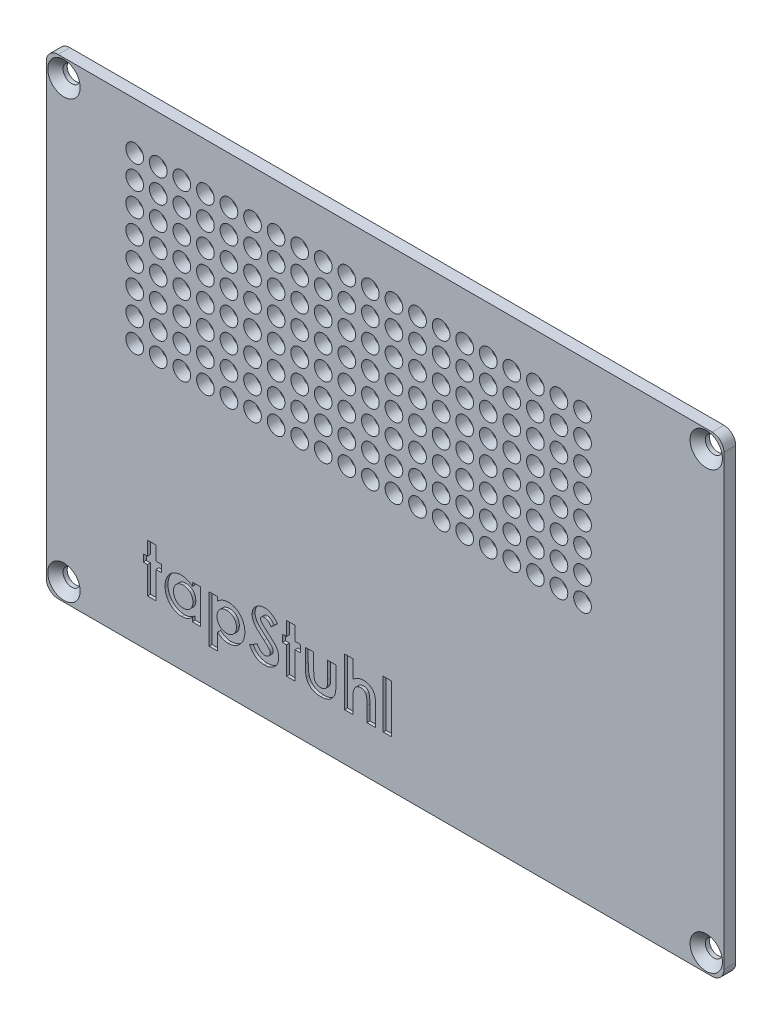
from build123d import *

# Parameters (mm, degrees)
BOSS_EXTRUDE1_DEPTH                          = 2
BOSS_EXTRUDE2_DEPTH                          = 1
SKETCH5_R                                    = 1.5
CUT_EXTRUDE1_DEPTH                           = 141.121375957
CSK_FOR_M2_5_COUNTERSUNK_FLAT_HEAD_S_2_COUNT = 2
CSK_FOR_M2_5_COUNTERSUNK_FLAT_HEAD_S_2_PITCH = 74
CSK_FOR_M2_5_COUNTERSUNK_FLAT_HEAD_S_3_COUNT = 2
CSK_FOR_M2_5_COUNTERSUNK_FLAT_HEAD_S_3_PITCH = 131.74596768
CSK_FOR_M2_5_COUNTERSUNK_FLAT_HEAD_S_4_COUNT = 2
CSK_FOR_M2_5_COUNTERSUNK_FLAT_HEAD_S_4_PITCH = 109
SKETCH12_W                                   = 1.435897436
SKETCH12_H                                   = 8.205128205
CUT_EXTRUDE2_DEPTH                           = 0.5


with BuildPart() as part:
    # Sketch1 → Boss-Extrude1 (new body)
    with BuildSketch(Plane.XY):
        with BuildLine():
            Line((113, 80), (2, 80))
            ThreePointArc((2, 80), (0.585786438, 79.414213562), (0, 78))
            Line((0, 78), (0, 2))
            ThreePointArc((0, 2), (0.585786438, 0.585786438), (2, 0))
            Line((2, 0), (113, 0))
            ThreePointArc((113, 0), (114.414213562, 0.585786438), (115, 2))
            Line((115, 2), (115, 78))
            ThreePointArc((115, 78), (114.414213562, 79.414213562), (113, 80))
        make_face()
    extrude(amount=BOSS_EXTRUDE1_DEPTH)

    # Sketch4 → Boss-Extrude2 (add)
    with BuildSketch(Plane(origin=(0, 0, 0), x_dir=(-1, 0, 0), z_dir=(0, 0, -1))):
        with BuildLine():
            Line((-7.523059585, 77.3), (-107.417157288, 77.3))
            Line((-107.417157288, 77.3), (-112.3, 72.417157288))
            Line((-112.3, 72.417157288), (-112.3, 7.582842712))
            Line((-112.3, 7.582842712), (-107.417157288, 2.7))
            Line((-107.417157288, 2.7), (-7.582842712, 2.7))
            Line((-7.582842712, 2.7), (-2.7, 7.582842712))
            Line((-2.7, 7.582842712), (-2.7, 72.476940415))
            ThreePointArc((-2.7, 72.476940415), (-4.425843797, 75.574156203), (-7.523059585, 77.3))
        make_face()
        with BuildLine():
            Line((-7.70897638, 75.8), (-106.795836944, 75.8))
            Line((-106.795836944, 75.8), (-110.8, 71.795836944))
            Line((-110.8, 71.795836944), (-110.8, 8.204163056))
            Line((-110.8, 8.204163056), (-106.795836944, 4.2))
            Line((-106.795836944, 4.2), (-8.204163056, 4.2))
            Line((-8.204163056, 4.2), (-4.2, 8.204163056))
            Line((-4.2, 8.204163056), (-4.2, 72.29102362))
            ThreePointArc((-4.2, 72.29102362), (-5.486503969, 74.513496031), (-7.70897638, 75.8))
        make_face(mode=Mode.SUBTRACT)
    extrude(amount=BOSS_EXTRUDE2_DEPTH)

    # Sketch5 → Cut-Extrude1 (cut, through all)
    with BuildSketch(Plane.XY.offset(2)):
        with Locations((15, 72)):
            Circle(SKETCH5_R)
        with Locations((19, 72)):
            Circle(SKETCH5_R)
        with Locations((23, 72)):
            Circle(SKETCH5_R)
        with Locations((27, 72)):
            Circle(SKETCH5_R)
        with Locations((31, 72)):
            Circle(SKETCH5_R)
        with Locations((35, 72)):
            Circle(SKETCH5_R)
        with Locations((39, 72)):
            Circle(SKETCH5_R)
        with Locations((43, 72)):
            Circle(SKETCH5_R)
        with Locations((19, 68)):
            Circle(SKETCH5_R)
        with Locations((23, 68)):
            Circle(SKETCH5_R)
        with Locations((27, 68)):
            Circle(SKETCH5_R)
        with Locations((31, 68)):
            Circle(SKETCH5_R)
        with Locations((35, 68)):
            Circle(SKETCH5_R)
        with Locations((39, 68)):
            Circle(SKETCH5_R)
        with Locations((43, 68)):
            Circle(SKETCH5_R)
        with Locations((19, 64)):
            Circle(SKETCH5_R)
        with Locations((23, 64)):
            Circle(SKETCH5_R)
        with Locations((27, 64)):
            Circle(SKETCH5_R)
        with Locations((31, 64)):
            Circle(SKETCH5_R)
        with Locations((35, 64)):
            Circle(SKETCH5_R)
        with Locations((39, 64)):
            Circle(SKETCH5_R)
        with Locations((43, 64)):
            Circle(SKETCH5_R)
        with Locations((19, 60)):
            Circle(SKETCH5_R)
        with Locations((23, 60)):
            Circle(SKETCH5_R)
        with Locations((27, 60)):
            Circle(SKETCH5_R)
        with Locations((31, 60)):
            Circle(SKETCH5_R)
        with Locations((35, 60)):
            Circle(SKETCH5_R)
        with Locations((39, 60)):
            Circle(SKETCH5_R)
        with Locations((43, 60)):
            Circle(SKETCH5_R)
        with Locations((15, 68)):
            Circle(SKETCH5_R)
        with Locations((15, 64)):
            Circle(SKETCH5_R)
        with Locations((15, 60)):
            Circle(SKETCH5_R)
        with Locations((15, 56)):
            Circle(SKETCH5_R)
        with Locations((19, 56)):
            Circle(SKETCH5_R)
        with Locations((23, 56)):
            Circle(SKETCH5_R)
        with Locations((27, 56)):
            Circle(SKETCH5_R)
        with Locations((31, 56)):
            Circle(SKETCH5_R)
        with Locations((35, 56)):
            Circle(SKETCH5_R)
        with Locations((39, 56)):
            Circle(SKETCH5_R)
        with Locations((43, 56)):
            Circle(SKETCH5_R)
        with Locations((15, 52)):
            Circle(SKETCH5_R)
        with Locations((19, 52)):
            Circle(SKETCH5_R)
        with Locations((23, 52)):
            Circle(SKETCH5_R)
        with Locations((27, 52)):
            Circle(SKETCH5_R)
        with Locations((31, 52)):
            Circle(SKETCH5_R)
        with Locations((35, 52)):
            Circle(SKETCH5_R)
        with Locations((39, 52)):
            Circle(SKETCH5_R)
        with Locations((43, 52)):
            Circle(SKETCH5_R)
        with Locations((15, 48)):
            Circle(SKETCH5_R)
        with Locations((19, 48)):
            Circle(SKETCH5_R)
        with Locations((23, 48)):
            Circle(SKETCH5_R)
        with Locations((27, 48)):
            Circle(SKETCH5_R)
        with Locations((31, 48)):
            Circle(SKETCH5_R)
        with Locations((35, 48)):
            Circle(SKETCH5_R)
        with Locations((39, 48)):
            Circle(SKETCH5_R)
        with Locations((43, 48)):
            Circle(SKETCH5_R)
        with Locations((47, 72)):
            Circle(SKETCH5_R)
        with Locations((51, 72)):
            Circle(SKETCH5_R)
        with Locations((47, 68)):
            Circle(SKETCH5_R)
        with Locations((51, 68)):
            Circle(SKETCH5_R)
        with Locations((47, 64)):
            Circle(SKETCH5_R)
        with Locations((51, 64)):
            Circle(SKETCH5_R)
        with Locations((47, 60)):
            Circle(SKETCH5_R)
        with Locations((51, 60)):
            Circle(SKETCH5_R)
        with Locations((47, 56)):
            Circle(SKETCH5_R)
        with Locations((51, 56)):
            Circle(SKETCH5_R)
        with Locations((47, 52)):
            Circle(SKETCH5_R)
        with Locations((51, 52)):
            Circle(SKETCH5_R)
        with Locations((47, 48)):
            Circle(SKETCH5_R)
        with Locations((51, 48)):
            Circle(SKETCH5_R)
        with Locations((55, 72)):
            Circle(SKETCH5_R)
        with Locations((59, 72)):
            Circle(SKETCH5_R)
        with Locations((63, 72)):
            Circle(SKETCH5_R)
        with Locations((67, 72)):
            Circle(SKETCH5_R)
        with Locations((71, 72)):
            Circle(SKETCH5_R)
        with Locations((75, 72)):
            Circle(SKETCH5_R)
        with Locations((79, 72)):
            Circle(SKETCH5_R)
        with Locations((83, 72)):
            Circle(SKETCH5_R)
        with Locations((87, 72)):
            Circle(SKETCH5_R)
        with Locations((91, 72)):
            Circle(SKETCH5_R)
        with Locations((55, 68)):
            Circle(SKETCH5_R)
        with Locations((59, 68)):
            Circle(SKETCH5_R)
        with Locations((63, 68)):
            Circle(SKETCH5_R)
        with Locations((67, 68)):
            Circle(SKETCH5_R)
        with Locations((71, 68)):
            Circle(SKETCH5_R)
        with Locations((75, 68)):
            Circle(SKETCH5_R)
        with Locations((79, 68)):
            Circle(SKETCH5_R)
        with Locations((83, 68)):
            Circle(SKETCH5_R)
        with Locations((87, 68)):
            Circle(SKETCH5_R)
        with Locations((91, 68)):
            Circle(SKETCH5_R)
        with Locations((55, 64)):
            Circle(SKETCH5_R)
        with Locations((59, 64)):
            Circle(SKETCH5_R)
        with Locations((63, 64)):
            Circle(SKETCH5_R)
        with Locations((67, 64)):
            Circle(SKETCH5_R)
        with Locations((71, 64)):
            Circle(SKETCH5_R)
        with Locations((75, 64)):
            Circle(SKETCH5_R)
        with Locations((79, 64)):
            Circle(SKETCH5_R)
        with Locations((83, 64)):
            Circle(SKETCH5_R)
        with Locations((87, 64)):
            Circle(SKETCH5_R)
        with Locations((91, 64)):
            Circle(SKETCH5_R)
        with Locations((55, 60)):
            Circle(SKETCH5_R)
        with Locations((59, 60)):
            Circle(SKETCH5_R)
        with Locations((63, 60)):
            Circle(SKETCH5_R)
        with Locations((67, 60)):
            Circle(SKETCH5_R)
        with Locations((71, 60)):
            Circle(SKETCH5_R)
        with Locations((75, 60)):
            Circle(SKETCH5_R)
        with Locations((79, 60)):
            Circle(SKETCH5_R)
        with Locations((83, 60)):
            Circle(SKETCH5_R)
        with Locations((87, 60)):
            Circle(SKETCH5_R)
        with Locations((91, 60)):
            Circle(SKETCH5_R)
        with Locations((55, 56)):
            Circle(SKETCH5_R)
        with Locations((59, 56)):
            Circle(SKETCH5_R)
        with Locations((63, 56)):
            Circle(SKETCH5_R)
        with Locations((67, 56)):
            Circle(SKETCH5_R)
        with Locations((71, 56)):
            Circle(SKETCH5_R)
        with Locations((75, 56)):
            Circle(SKETCH5_R)
        with Locations((79, 56)):
            Circle(SKETCH5_R)
        with Locations((83, 56)):
            Circle(SKETCH5_R)
        with Locations((87, 56)):
            Circle(SKETCH5_R)
        with Locations((91, 56)):
            Circle(SKETCH5_R)
        with Locations((55, 52)):
            Circle(SKETCH5_R)
        with Locations((59, 52)):
            Circle(SKETCH5_R)
        with Locations((63, 52)):
            Circle(SKETCH5_R)
        with Locations((67, 52)):
            Circle(SKETCH5_R)
        with Locations((71, 52)):
            Circle(SKETCH5_R)
        with Locations((75, 52)):
            Circle(SKETCH5_R)
        with Locations((79, 52)):
            Circle(SKETCH5_R)
        with Locations((83, 52)):
            Circle(SKETCH5_R)
        with Locations((87, 52)):
            Circle(SKETCH5_R)
        with Locations((91, 52)):
            Circle(SKETCH5_R)
        with Locations((55, 48)):
            Circle(SKETCH5_R)
        with Locations((59, 48)):
            Circle(SKETCH5_R)
        with Locations((63, 48)):
            Circle(SKETCH5_R)
        with Locations((67, 48)):
            Circle(SKETCH5_R)
        with Locations((71, 48)):
            Circle(SKETCH5_R)
        with Locations((75, 48)):
            Circle(SKETCH5_R)
        with Locations((79, 48)):
            Circle(SKETCH5_R)
        with Locations((83, 48)):
            Circle(SKETCH5_R)
        with Locations((87, 48)):
            Circle(SKETCH5_R)
        with Locations((91, 48)):
            Circle(SKETCH5_R)
        with Locations((15, 44)):
            Circle(SKETCH5_R)
        with Locations((19, 44)):
            Circle(SKETCH5_R)
        with Locations((23, 44)):
            Circle(SKETCH5_R)
        with Locations((27, 44)):
            Circle(SKETCH5_R)
        with Locations((31, 44)):
            Circle(SKETCH5_R)
        with Locations((35, 44)):
            Circle(SKETCH5_R)
        with Locations((39, 44)):
            Circle(SKETCH5_R)
        with Locations((43, 44)):
            Circle(SKETCH5_R)
        with Locations((47, 44)):
            Circle(SKETCH5_R)
        with Locations((51, 44)):
            Circle(SKETCH5_R)
        with Locations((55, 44)):
            Circle(SKETCH5_R)
        with Locations((59, 44)):
            Circle(SKETCH5_R)
        with Locations((63, 44)):
            Circle(SKETCH5_R)
        with Locations((67, 44)):
            Circle(SKETCH5_R)
        with Locations((71, 44)):
            Circle(SKETCH5_R)
        with Locations((75, 44)):
            Circle(SKETCH5_R)
        with Locations((79, 44)):
            Circle(SKETCH5_R)
        with Locations((83, 44)):
            Circle(SKETCH5_R)
        with Locations((87, 44)):
            Circle(SKETCH5_R)
        with Locations((91, 44)):
            Circle(SKETCH5_R)
    extrude(amount=-CUT_EXTRUDE1_DEPTH, mode=Mode.SUBTRACT)

    # Sketch11 → CSK for M2.5 Countersunk Flat Head Screw1 (revolve, cut)
    with BuildSketch(Plane(origin=(3, 77, 2), x_dir=(0, -1, 0), z_dir=(1, 0, 0))):
        Polygon((0, 0), (0, 2), (1.45, 2), (1.45, 1.3), (2.75, 0), align=None)
    csk_for_m2_5_countersunk_flat_head_screw = revolve(axis=Axis((3, 77, 8.35), (0, 0, -1)), mode=Mode.SUBTRACT)

    # CSK for M2.5 Countersunk Flat Head S 2: CSK for M2.5 Countersunk Flat Head Screw1 ×2
    with Locations(*[(0, -i * CSK_FOR_M2_5_COUNTERSUNK_FLAT_HEAD_S_2_PITCH, 0) for i in range(1, CSK_FOR_M2_5_COUNTERSUNK_FLAT_HEAD_S_2_COUNT)]):
        add(csk_for_m2_5_countersunk_flat_head_screw, mode=Mode.SUBTRACT)

    # CSK for M2.5 Countersunk Flat Head S 3: CSK for M2.5 Countersunk Flat Head Screw1 ×2
    with Locations(*[Vector(0.8273497999161711, -0.5616870201265752, 0) * (i * CSK_FOR_M2_5_COUNTERSUNK_FLAT_HEAD_S_3_PITCH) for i in range(1, CSK_FOR_M2_5_COUNTERSUNK_FLAT_HEAD_S_3_COUNT)]):
        add(csk_for_m2_5_countersunk_flat_head_screw, mode=Mode.SUBTRACT)

    # CSK for M2.5 Countersunk Flat Head S 4: CSK for M2.5 Countersunk Flat Head Screw1 ×2
    with Locations(*[(i * CSK_FOR_M2_5_COUNTERSUNK_FLAT_HEAD_S_4_PITCH, 0, 0) for i in range(1, CSK_FOR_M2_5_COUNTERSUNK_FLAT_HEAD_S_4_COUNT)]):
        add(csk_for_m2_5_countersunk_flat_head_screw, mode=Mode.SUBTRACT)

    # Sketch12 → Cut-Extrude2 (cut)
    # profile 1 of 8: a face of its own
    with BuildSketch(Plane.XY.offset(2)):
        Polygon((17.184704169, 16.205128205), (18.620601605, 16.205128205), (18.620601605, 13.846153846), (19.543678528, 13.846153846), (19.543678528, 12.615384615), (18.620601605, 12.615384615), (18.620601605, 8), (17.184704169, 8), (17.184704169, 12.615384615), (16.466755451, 12.615384615), (16.466755451, 13.846153846), (17.184704169, 13.846153846), align=None)
    # profile 2 of 8: a face of its own
    with BuildSketch(Plane.XY.offset(2)):
        with BuildLine():
            Line((24.774447758, 13.846153846), (26.210345194, 13.846153846))
            Line((26.210345194, 13.846153846), (26.210345194, 8))
            Line((26.210345194, 8), (24.774447758, 8))
            Line((24.774447758, 8), (24.774447758, 8.637820513))
            add(Edge.make_bspline(
                [(24.774447758, 8.637820513), (24.70329957, 8.575735745), (24.565214985, 8.455241472), (24.347638362, 8.298897088), (24.129425955, 8.169933177), (23.909529247, 8.067220456), (23.684568518, 7.991377683), (23.452924141, 7.936465743), (23.211260191, 7.904082829), (23.046980367, 7.899674621), (22.963550323, 7.897435897)],
                knots=[0, 0, 0, 0, 1.129196829, 2.191548051, 3.199897424, 4.157751732, 5.089409408, 6.034969131, 7.002052659, 8, 8, 8, 8], degree=3))
            add(Edge.make_bspline(
                [(22.963550323, 7.897435897), (22.869896389, 7.899542818), (22.684830907, 7.903706212), (22.413267859, 7.947532657), (22.151046737, 8.014618799), (21.898380394, 8.109554075), (21.655728532, 8.23257158), (21.421234129, 8.380461618), (21.198917133, 8.558416011), (20.986926831, 8.758735128), (20.792829783, 8.979087582), (20.62314831, 9.216414911), (20.48011944, 9.467351151), (20.36294354, 9.731064332), (20.270769563, 10.007360905), (20.205062707, 10.297117197), (20.166295586, 10.600436696), (20.161497309, 10.80704606), (20.159063143, 10.911858974)],
                knots=[0, 0, 0, 0, 0.980476535, 1.937477201, 2.874147792, 3.812856188, 4.758993464, 5.720109578, 6.712210464, 7.737600662, 8.772720504, 9.783789959, 10.789002326, 11.793715968, 12.802552247, 13.835794126, 14.902098527, 16, 16, 16, 16], degree=3))
            add(Edge.make_bspline(
                [(20.159063143, 10.911858974), (20.161617809, 11.020392885), (20.166629071, 11.233294244), (20.203286152, 11.545716865), (20.26778047, 11.842657641), (20.355723108, 12.124527878), (20.468846041, 12.391376271), (20.606622215, 12.643640005), (20.770925946, 12.880659702), (20.960256869, 13.09840112), (21.164687763, 13.297971647), (21.38339268, 13.471713617), (21.612951553, 13.619315505), (21.853608329, 13.739815925), (22.10532864, 13.832932551), (22.367118698, 13.901008408), (22.640140666, 13.941856314), (22.826125444, 13.946411742), (22.920281092, 13.948717949)],
                knots=[0, 0, 0, 0, 1.136281865, 2.228943489, 3.287578264, 4.313574083, 5.316051562, 6.317280042, 7.318008486, 8.329309503, 9.333984563, 10.305318864, 11.248632312, 12.186624717, 13.117503092, 14.05354244, 15.014596925, 16, 16, 16, 16], degree=3))
            add(Edge.make_bspline(
                [(22.920281092, 13.948717949), (23.00749973, 13.946905963), (23.180073976, 13.943320697), (23.433733254, 13.904391569), (23.679746168, 13.845514026), (23.916770706, 13.761624127), (24.146751021, 13.655696062), (24.365731308, 13.5229603), (24.578501958, 13.368995668), (24.708325508, 13.248746028), (24.774447758, 13.1875)],
                knots=[0, 0, 0, 0, 1.017011718, 2.012299608, 2.98747302, 3.965332399, 4.941441765, 5.936729654, 6.94912688, 8, 8, 8, 8], degree=3))
            Line((24.774447758, 13.1875), (24.774447758, 13.846153846))
        make_face()
        with BuildLine():
            add(Edge.make_bspline(
                [(23.221563143, 12.615384615), (23.164346863, 12.613629022), (23.05220669, 12.610188175), (22.887289219, 12.589491236), (22.72967759, 12.553022309), (22.580495877, 12.4991473), (22.437520723, 12.433519689), (22.30292323, 12.351322187), (22.175592523, 12.254166486), (22.056277448, 12.144404724), (21.947504176, 12.02375648), (21.853735268, 11.892103105), (21.774046845, 11.752991911), (21.70665115, 11.606004637), (21.658411123, 11.449401969), (21.620205042, 11.285222597), (21.600378559, 11.112125258), (21.596784643, 10.994164779), (21.594960579, 10.934294872)],
                knots=[0, 0, 0, 0, 1.04836806, 2.054732945, 3.03993516, 4.00574415, 4.955904794, 5.917688631, 6.888591924, 7.88601754, 8.884115178, 9.859153345, 10.841239365, 11.818093293, 12.814750328, 13.83810466, 14.90274714, 16, 16, 16, 16], degree=3))
            add(Edge.make_bspline(
                [(21.594960579, 10.934294872), (21.59675678, 10.87388191), (21.600296172, 10.754838869), (21.620525617, 10.580281392), (21.657356886, 10.413703745), (21.711092318, 10.256452594), (21.776715745, 10.106406102), (21.856594214, 9.964256747), (21.954710923, 9.832517907), (22.063579546, 9.7080722), (22.185342351, 9.596947012), (22.313393547, 9.498278049), (22.44948221, 9.41572179), (22.592131877, 9.3489993), (22.74086238, 9.294626079), (22.89753835, 9.258615491), (23.060624949, 9.235594604), (23.171805389, 9.232388795), (23.227973399, 9.230769231)],
                knots=[0, 0, 0, 0, 1.099136573, 2.165835871, 3.191374663, 4.196217796, 5.183857741, 6.167377911, 7.154730987, 8.166690795, 9.170734848, 10.148332609, 11.103258353, 12.059567475, 13.009337315, 13.978056681, 14.978520572, 16, 16, 16, 16], degree=3))
            add(Edge.make_bspline(
                [(23.227973399, 9.230769231), (23.2862554, 9.232534666), (23.400519803, 9.235995879), (23.568127819, 9.256503935), (23.727856738, 9.293106579), (23.879042001, 9.347290035), (24.023992819, 9.41244657), (24.161401142, 9.49303787), (24.289775882, 9.589970625), (24.409767199, 9.700724636), (24.519716109, 9.822358046), (24.614781767, 9.955737845), (24.697587433, 10.096598182), (24.76271028, 10.248269509), (24.814426953, 10.408098286), (24.851532473, 10.577076443), (24.871715724, 10.755386159), (24.875224161, 10.877089489), (24.877011861, 10.939102564)],
                knots=[0, 0, 0, 0, 1.050008698, 2.058587853, 3.036635738, 3.995319155, 4.947022481, 5.895997462, 6.858296291, 7.838991643, 8.833936038, 9.806048392, 10.784806122, 11.771666913, 12.772873988, 13.80724452, 14.882696879, 16, 16, 16, 16], degree=3))
            add(Edge.make_bspline(
                [(24.877011861, 10.939102564), (24.875246375, 11.000049044), (24.871797869, 11.119095223), (24.851445428, 11.293681916), (24.81407648, 11.459342114), (24.763424221, 11.616380321), (24.697142819, 11.764437469), (24.6142745, 11.90187196), (24.520251658, 12.033445383), (24.409085454, 12.151792801), (24.289744158, 12.261744868), (24.159481459, 12.355746306), (24.02240134, 12.436759354), (23.877661577, 12.50327419), (23.723921947, 12.552032087), (23.563920063, 12.589783543), (23.395159562, 12.610175753), (23.280372915, 12.613619994), (23.221563143, 12.615384615)],
                knots=[0, 0, 0, 0, 1.106611376, 2.161533483, 3.185006901, 4.184773755, 5.152708835, 6.122342771, 7.094156588, 8.082475533, 9.064254463, 10.03606828, 10.992420271, 11.951521816, 12.920622147, 13.915721683, 14.932141191, 16, 16, 16, 16], degree=3))
        make_face(mode=Mode.SUBTRACT)
    # profile 3 of 8: a face of its own
    with BuildSketch(Plane.XY.offset(2)):
        with BuildLine():
            Line((29.082140066, 13.846153846), (29.082140066, 13.1875))
            add(Edge.make_bspline(
                [(29.082140066, 13.1875), (29.148802475, 13.248748216), (29.279720567, 13.369033391), (29.4940689, 13.523034321), (29.714344168, 13.655297223), (29.944593697, 13.761678991), (30.181657618, 13.845499403), (30.427660162, 13.904395444), (30.680792708, 13.943238964), (30.852829175, 13.946882239), (30.939511861, 13.948717949)],
                knots=[0, 0, 0, 0, 1.054376801, 2.070687235, 3.070225973, 4.045259405, 5.022040922, 5.996139433, 6.99033025, 8, 8, 8, 8], degree=3))
            add(Edge.make_bspline(
                [(30.939511861, 13.948717949), (31.033676449, 13.946462469), (31.219150133, 13.942019907), (31.492039368, 13.900542206), (31.753554426, 13.833496356), (32.004692532, 13.739882076), (32.244115651, 13.618339568), (32.474513871, 13.472815364), (32.691913706, 13.297304335), (32.896420839, 13.098508668), (33.085595031, 12.880613848), (33.25014174, 12.643715934), (33.387202763, 12.390932957), (33.503368714, 12.125253338), (33.588151291, 11.842270872), (33.653494627, 11.545781576), (33.689907601, 11.233277089), (33.694952744, 11.020387092), (33.697524682, 10.911858974)],
                knots=[0, 0, 0, 0, 0.985987466, 1.942075377, 2.884088208, 3.810275091, 4.743821533, 5.692411115, 6.659945104, 7.665215984, 8.677116751, 9.678438675, 10.680260931, 11.685531812, 12.710472044, 13.769734641, 14.863044265, 16, 16, 16, 16], degree=3))
            add(Edge.make_bspline(
                [(33.697524682, 10.911858974), (33.695090514, 10.807046063), (33.690292232, 10.600436705), (33.651525143, 10.297117165), (33.585818172, 10.00736102), (33.493644609, 9.731063915), (33.376467177, 9.467352703), (33.233444034, 9.216409097), (33.063740894, 8.979109637), (32.869726412, 8.758650986), (32.657737397, 8.559009289), (32.436860038, 8.379890995), (32.202695185, 8.233117598), (31.961096435, 8.109156221), (31.708257693, 8.014365354), (31.445905959, 7.947953698), (31.174456732, 7.903553386), (30.989904321, 7.89949537), (30.89624263, 7.897435897)],
                knots=[0, 0, 0, 0, 1.098553145, 2.165490463, 3.199345634, 4.208780719, 5.21409072, 6.219899742, 7.23156933, 8.267303578, 9.293302409, 10.281606823, 11.243293419, 12.184993323, 13.124258899, 14.066907486, 15.018941492, 16, 16, 16, 16], degree=3))
            add(Edge.make_bspline(
                [(30.89624263, 7.897435897), (30.812779224, 7.89946005), (30.648361336, 7.90344751), (30.40658866, 7.939000775), (30.173033508, 7.992105267), (29.947386936, 8.072033448), (29.727112272, 8.178097473), (29.508457965, 8.310181038), (29.290918405, 8.471543596), (29.153225974, 8.596002514), (29.082140066, 8.66025641)],
                knots=[0, 0, 0, 0, 0.990856396, 1.951927477, 2.896945079, 3.83213376, 4.788585491, 5.796263726, 6.862286081, 8, 8, 8, 8], degree=3))
            Line((29.082140066, 8.66025641), (29.082140066, 5.846153846))
            Line((29.082140066, 5.846153846), (27.64624263, 5.846153846))
            Line((27.64624263, 5.846153846), (27.64624263, 13.846153846))
            Line((27.64624263, 13.846153846), (29.082140066, 13.846153846))
        make_face()
        with BuildLine():
            add(Edge.make_bspline(
                [(30.628614425, 12.615384615), (30.570341423, 12.613592681), (30.456094662, 12.610079514), (30.288359608, 12.589945572), (30.12942769, 12.552063415), (29.976882479, 12.502964259), (29.832655636, 12.43668811), (29.69556722, 12.356347794), (29.566791408, 12.2605481), (29.445659856, 12.153082578), (29.336813526, 12.032183663), (29.240113004, 11.902996902), (29.15988704, 11.76384004), (29.093009955, 11.616477569), (29.042554116, 11.459315043), (29.005130502, 11.293689445), (28.984793139, 11.119093208), (28.981342527, 11.000048361), (28.979575964, 10.939102564)],
                knots=[0, 0, 0, 0, 1.060469436, 2.079096586, 3.066888298, 4.028858836, 4.99004353, 5.948472697, 6.914558426, 7.905691313, 8.889602648, 9.869280844, 10.836099585, 11.806137001, 12.808075328, 13.83377171, 14.890985086, 16, 16, 16, 16], degree=3))
            add(Edge.make_bspline(
                [(28.979575964, 10.939102564), (28.981364756, 10.877090166), (28.984875338, 10.755388164), (29.005043162, 10.577068895), (29.042204101, 10.408125052), (29.093722635, 10.248173594), (29.159461716, 10.097193771), (29.239592628, 9.954625876), (29.337357573, 9.823595639), (29.445008185, 9.699509141), (29.566888723, 9.590605707), (29.695084397, 9.492934308), (29.83262233, 9.412474235), (29.977538439, 9.347282558), (30.128733114, 9.293108631), (30.288459442, 9.256503365), (30.456068171, 9.23599603), (30.570332475, 9.232534717), (30.628614425, 9.230769231)],
                knots=[0, 0, 0, 0, 1.117193555, 2.192540452, 3.22680955, 4.227918444, 5.21468246, 6.188555072, 7.166222992, 8.154674427, 9.142376254, 10.104580718, 11.053462639, 12.005072638, 12.963662044, 13.941614018, 14.950094269, 16, 16, 16, 16], degree=3))
            add(Edge.make_bspline(
                [(30.628614425, 9.230769231), (30.684776387, 9.232409314), (30.795944855, 9.235655737), (30.958603158, 9.258308139), (31.11495831, 9.295324416), (31.263785846, 9.348086002), (31.405991736, 9.416781532), (31.542870581, 9.497166672), (31.66969681, 9.597601904), (31.791446027, 9.707988798), (31.900379049, 9.832473466), (31.998105062, 9.964722031), (32.080197817, 10.105914837), (32.14537753, 10.2565201), (32.199263456, 10.413685139), (32.236053078, 10.580286616), (32.256294054, 10.754837495), (32.259831854, 10.873881447), (32.261627246, 10.934294872)],
                knots=[0, 0, 0, 0, 1.021711385, 2.02240246, 2.981887075, 3.941027022, 4.888772411, 5.852236371, 6.822344989, 7.82661704, 8.838806642, 9.826383926, 10.814965113, 11.80282933, 12.807900643, 13.833672313, 14.900613836, 16, 16, 16, 16], degree=3))
            add(Edge.make_bspline(
                [(32.261627246, 10.934294872), (32.259803182, 10.994164779), (32.256209266, 11.112125258), (32.236382782, 11.285222596), (32.198176704, 11.449401974), (32.149936666, 11.60600462), (32.08254101, 11.752991973), (32.002852442, 11.892102872), (31.909084077, 12.023757352), (31.800308734, 12.144401385), (31.681001355, 12.254178789), (31.553642759, 12.351277807), (31.418733097, 12.433936738), (31.274435192, 12.499122667), (31.124154249, 12.552756638), (30.965593662, 12.589700427), (30.799559536, 12.610147186), (30.686361443, 12.613615358), (30.628614425, 12.615384615)],
                knots=[0, 0, 0, 0, 1.094680664, 2.156827393, 3.177782763, 4.17210342, 5.146667393, 6.126451192, 7.099203661, 8.094961544, 9.09004898, 10.058676268, 11.018205477, 11.974998356, 12.947750825, 13.930643515, 14.944335875, 16, 16, 16, 16], degree=3))
        make_face(mode=Mode.SUBTRACT)
    # profile 4 of 8: a face of its own
    with BuildSketch(Plane.XY.offset(2)):
        with BuildLine():
            Line((39.23598622, 14.931089744), (38.162268271, 13.948717949))
            add(Edge.make_bspline(
                [(38.162268271, 13.948717949), (38.116274798, 14.013596524), (38.027973744, 14.13815434), (37.884846946, 14.304940193), (37.742366438, 14.447220936), (37.599212226, 14.564402189), (37.454115445, 14.655771987), (37.307327963, 14.720462813), (37.159681957, 14.761587385), (37.060486632, 14.766708384), (37.011627246, 14.769230769)],
                knots=[0, 0, 0, 0, 1.299362458, 2.494594718, 3.587462134, 4.587049575, 5.512617175, 6.380583204, 7.202344345, 8, 8, 8, 8], degree=3))
            add(Edge.make_bspline(
                [(37.011627246, 14.769230769), (36.966052611, 14.76763247), (36.878059966, 14.764546574), (36.752619922, 14.733873), (36.641252465, 14.680934914), (36.544066283, 14.611713914), (36.467080489, 14.528318657), (36.405613303, 14.440858475), (36.371002111, 14.344322214), (36.366446598, 14.278017215), (36.364191348, 14.245192308)],
                knots=[0, 0, 0, 0, 1.185010067, 2.2879431, 3.333075148, 4.379039566, 5.372662701, 6.27520591, 7.14612461, 8, 8, 8, 8], degree=3))
            add(Edge.make_bspline(
                [(36.364191348, 14.245192308), (36.365604599, 14.21189405), (36.368450689, 14.144835988), (36.395940046, 14.046554046), (36.437374357, 13.950521147), (36.476966533, 13.892061352), (36.497204169, 13.862179487)],
                knots=[0, 0, 0, 0, 0.967525499, 1.948461899, 2.951351359, 4, 4, 4, 4], degree=3))
            add(Edge.make_bspline(
                [(36.497204169, 13.862179487), (36.515602369, 13.838952626), (36.557952596, 13.78548746), (36.638705806, 13.70080697), (36.740114877, 13.597065958), (36.866082245, 13.477831774), (37.011378658, 13.338816288), (37.182738792, 13.185484254), (37.375230155, 13.013087156), (37.512048557, 12.89303606), (37.58374263, 12.830128205)],
                knots=[0, 0, 0, 0, 0.473873513, 1.090794244, 1.870441696, 2.795289791, 3.865433203, 5.087734844, 6.473946851, 8, 8, 8, 8], degree=3))
            add(Edge.make_bspline(
                [(37.58374263, 12.830128205), (37.651037831, 12.771887603), (37.778750142, 12.66135904), (37.960459398, 12.504481491), (38.120151572, 12.363342586), (38.260153012, 12.240060517), (38.378341434, 12.133341773), (38.475213703, 12.04267624), (38.551952948, 11.969829009), (38.595574716, 11.925829237), (38.614191348, 11.907051282)],
                knots=[0, 0, 0, 0, 1.543621617, 2.929473131, 4.163658386, 5.240097082, 6.164993805, 6.925417477, 7.541396219, 8, 8, 8, 8], degree=3))
            add(Edge.make_bspline(
                [(38.614191348, 11.907051282), (38.68481897, 11.830617069), (38.820590062, 11.68368367), (38.997044619, 11.45598311), (39.142272428, 11.233700934), (39.254623414, 11.012654544), (39.339475398, 10.789654678), (39.399297171, 10.559232278), (39.435124828, 10.318979574), (39.439102535, 10.155036433), (39.441114425, 10.072115385)],
                knots=[0, 0, 0, 0, 1.206664779, 2.319633467, 3.337109185, 4.282041471, 5.190008762, 6.099243693, 7.03861361, 8, 8, 8, 8], degree=3))
            add(Edge.make_bspline(
                [(39.441114425, 10.072115385), (39.439682413, 9.991318993), (39.436872753, 9.832793465), (39.402459798, 9.600814968), (39.353388944, 9.378801479), (39.277516796, 9.169168817), (39.185044272, 8.968475928), (39.069116606, 8.779848967), (38.932975459, 8.601378953), (38.776936801, 8.436256255), (38.604339517, 8.286418853), (38.419212526, 8.153030058), (38.219745564, 8.042900617), (38.007642844, 7.952216877), (37.783017902, 7.882371049), (37.546138332, 7.830748472), (37.296641811, 7.799765415), (37.126032495, 7.796526504), (37.038870835, 7.794871795)],
                knots=[0, 0, 0, 0, 1.043214005, 2.046824704, 3.02475056, 3.976699089, 4.921714032, 5.875962561, 6.831408892, 7.817874052, 8.806269674, 9.781291748, 10.760897367, 11.74438705, 12.757449933, 13.795994037, 14.874007457, 16, 16, 16, 16], degree=3))
            add(Edge.make_bspline(
                [(37.038870835, 7.794871795), (36.970449675, 7.796085632), (36.834936537, 7.798489725), (36.63521066, 7.818117146), (36.442352747, 7.849793716), (36.256580037, 7.895195702), (36.077055589, 7.952726176), (35.903772033, 8.022997447), (35.737925601, 8.107098693), (35.578261421, 8.203300457), (35.425555657, 8.315003377), (35.277877406, 8.439923723), (35.136693547, 8.579982827), (35.001326005, 8.734849454), (34.872640897, 8.904962148), (34.746425898, 9.087951777), (34.628290383, 9.287214378), (34.555312821, 9.426998705), (34.518037502, 9.498397436)],
                knots=[0, 0, 0, 0, 1.016823716, 2.013894106, 2.979844003, 3.91962641, 4.853723003, 5.779685073, 6.695824784, 7.614987388, 8.547259901, 9.504950863, 10.487499108, 11.500346958, 12.559593716, 13.656357062, 14.802919212, 16, 16, 16, 16], degree=3))
            Line((34.518037502, 9.498397436), (35.780858015, 10.256410256))
            add(Edge.make_bspline(
                [(35.780858015, 10.256410256), (35.827483868, 10.175363368), (35.916869613, 10.019989555), (36.068342114, 9.811225146), (36.223517958, 9.632452987), (36.385984673, 9.486832886), (36.553766722, 9.372417716), (36.727674534, 9.290648698), (36.907830291, 9.240033769), (37.030544209, 9.233852517), (37.091755451, 9.230769231)],
                knots=[0, 0, 0, 0, 1.283663364, 2.460892379, 3.537111102, 4.529833553, 5.449777664, 6.316464042, 7.160231139, 8, 8, 8, 8], degree=3))
            add(Edge.make_bspline(
                [(37.091755451, 9.230769231), (37.154016047, 9.233287209), (37.274810672, 9.238172454), (37.447229541, 9.283295991), (37.605309689, 9.354143253), (37.741953002, 9.455232527), (37.857653944, 9.571904913), (37.94304788, 9.701708277), (37.996692926, 9.842152384), (38.002364508, 9.939714099), (38.005216989, 9.988782051)],
                knots=[0, 0, 0, 0, 1.13588714, 2.203786484, 3.234766741, 4.283437687, 5.291419208, 6.222934724, 7.106237994, 8, 8, 8, 8], degree=3))
            add(Edge.make_bspline(
                [(38.005216989, 9.988782051), (38.00258284, 10.034431796), (37.997231818, 10.127164882), (37.957817839, 10.265044069), (37.896201768, 10.402860552), (37.823305611, 10.51590136), (37.749124643, 10.610547364), (37.678190906, 10.692553845), (37.591812379, 10.78315665), (37.49020808, 10.88246975), (37.374720466, 10.991367424), (37.245252254, 11.109839008), (37.100320896, 11.236840909), (36.997883126, 11.323353349), (36.944319553, 11.368589744)],
                knots=[0, 0, 0, 0, 0.916159276, 1.861089862, 2.860218735, 3.940849679, 4.552606315, 5.27541173, 6.11797699, 7.06649574, 8.129236253, 9.306560635, 10.591630461, 12, 12, 12, 12], degree=3))
            add(Edge.make_bspline(
                [(36.944319553, 11.368589744), (36.84249307, 11.454744713), (36.647057228, 11.620102176), (36.370881588, 11.864329943), (36.122022608, 12.09258317), (35.902629702, 12.307683565), (35.709907464, 12.505658723), (35.545161092, 12.688116674), (35.410200402, 12.856464831), (35.268183376, 13.055861957), (35.133238808, 13.298841056), (35.016608406, 13.59117308), (34.940943525, 13.883468011), (34.932466327, 14.079698729), (34.928293912, 14.176282051)],
                knots=[0, 0, 0, 0, 1.345494975, 2.582412109, 3.71882943, 4.751509156, 5.681369928, 6.505683931, 7.230279997, 7.856715994, 8.973648664, 10.023341002, 11.027102913, 12, 12, 12, 12], degree=3))
            add(Edge.make_bspline(
                [(34.928293912, 14.176282051), (34.930029214, 14.24477376), (34.933447945, 14.379709782), (34.96394355, 14.578113543), (35.009520394, 14.769556501), (35.075711056, 14.953340186), (35.161618543, 15.129234402), (35.26594985, 15.298100223), (35.390325043, 15.458383449), (35.530487489, 15.609977821), (35.684910619, 15.748517826), (35.849931357, 15.870793262), (36.024615673, 15.974068874), (36.207894935, 16.059743493), (36.400904848, 16.125321971), (36.602223519, 16.171807265), (36.812139701, 16.199455235), (36.954920157, 16.203213656), (37.027652887, 16.205128205)],
                knots=[0, 0, 0, 0, 1.010766082, 1.991317756, 2.957454644, 3.913069143, 4.869106762, 5.843196583, 6.838735724, 7.860187025, 8.887984031, 9.89767229, 10.887916223, 11.879572884, 12.879850636, 13.892031539, 14.926195476, 16, 16, 16, 16], degree=3))
            add(Edge.make_bspline(
                [(37.027652887, 16.205128205), (37.121910904, 16.201680046), (37.309682899, 16.194810946), (37.587309209, 16.141096832), (37.858482982, 16.056625729), (38.07699989, 15.954720636), (38.250869715, 15.856005125), (38.384124694, 15.765120318), (38.519718808, 15.661006885), (38.658745539, 15.54333674), (38.798621555, 15.409892822), (38.9433242, 15.263851868), (39.090881725, 15.103951742), (39.18677072, 14.989719834), (39.23598622, 14.931089744)],
                knots=[0, 0, 0, 0, 1.282922637, 2.555718331, 3.837320111, 5.142675274, 5.830281639, 6.55870424, 7.337177975, 8.157850921, 9.037902056, 9.96903443, 10.957596896, 12, 12, 12, 12], degree=3))
        make_face()
    # profile 5 of 8: a face of its own
    with BuildSketch(Plane.XY.offset(2)):
        Polygon((40.774447758, 16.205128205), (42.210345194, 16.205128205), (42.210345194, 13.846153846), (43.133422117, 13.846153846), (43.133422117, 12.615384615), (42.210345194, 12.615384615), (42.210345194, 8), (40.774447758, 8), (40.774447758, 12.615384615), (40.056499041, 12.615384615), (40.056499041, 13.846153846), (40.774447758, 13.846153846), align=None)
    # profile 6 of 8: a face of its own
    with BuildSketch(Plane.XY.offset(2)):
        with BuildLine():
            Line((43.953934938, 13.846153846), (45.389832374, 13.846153846))
            Line((45.389832374, 13.846153846), (45.389832374, 11.040064103))
            add(Edge.make_bspline(
                [(45.389832374, 11.040064103), (45.389959882, 10.974352254), (45.390204602, 10.84823517), (45.397014356, 10.667106346), (45.406569788, 10.50147233), (45.41849432, 10.35113781), (45.436292448, 10.216464391), (45.456839637, 10.097709167), (45.48013352, 9.994016493), (45.518012316, 9.878437184), (45.577274376, 9.751957858), (45.666770577, 9.617685202), (45.775176579, 9.501578615), (45.901027746, 9.402607711), (46.045609325, 9.324616466), (46.206929363, 9.271762989), (46.382958123, 9.236239957), (46.505561892, 9.232640867), (46.569319553, 9.230769231)],
                knots=[0, 0, 0, 0, 1.267339619, 2.432334223, 3.495366327, 4.467371443, 5.340232306, 6.114347373, 6.791623365, 7.387877112, 8.457231658, 9.474542289, 10.487879852, 11.508108106, 12.54995813, 13.638205937, 14.771795776, 16, 16, 16, 16], degree=3))
            add(Edge.make_bspline(
                [(46.569319553, 9.230769231), (46.633020636, 9.232905438), (46.755941477, 9.237027573), (46.933141426, 9.269173074), (47.094841435, 9.324255461), (47.242702268, 9.398968218), (47.372363499, 9.498958517), (47.485254231, 9.618104053), (47.580305578, 9.758326788), (47.625982134, 9.862928931), (47.649447758, 9.916666667)],
                knots=[0, 0, 0, 0, 1.116871431, 2.155171802, 3.144773418, 4.104381479, 5.046960687, 6.001340237, 6.973219418, 8, 8, 8, 8], degree=3))
            add(Edge.make_bspline(
                [(47.649447758, 9.916666667), (47.658058854, 9.940537451), (47.677066856, 9.993229453), (47.693984353, 10.084130408), (47.712192618, 10.191333367), (47.726596001, 10.317023035), (47.734745944, 10.460421005), (47.743477774, 10.621708006), (47.747927671, 10.800723408), (47.74850474, 10.926280343), (47.748806733, 10.991987179)],
                knots=[0, 0, 0, 0, 0.56094539, 1.238222264, 2.041156151, 2.969685991, 4.036367568, 5.220421584, 6.545382566, 8, 8, 8, 8], degree=3))
            Line((47.748806733, 10.991987179), (47.748806733, 13.846153846))
            Line((47.748806733, 13.846153846), (49.184704169, 13.846153846))
            Line((49.184704169, 13.846153846), (49.184704169, 11.389423077))
            add(Edge.make_bspline(
                [(49.184704169, 11.389423077), (49.184455544, 11.267613155), (49.183978857, 11.034066668), (49.170317273, 10.699051822), (49.151462741, 10.394456459), (49.127181729, 10.119441934), (49.092195792, 9.873894113), (49.049248691, 9.658388812), (49.001735485, 9.471501944), (48.958164104, 9.360770183), (48.937909297, 9.309294872)],
                knots=[0, 0, 0, 0, 1.388070971, 2.661352173, 3.82033814, 4.865898334, 5.806910977, 6.645039373, 7.370126333, 8, 8, 8, 8], degree=3))
            add(Edge.make_bspline(
                [(48.937909297, 9.309294872), (48.911947852, 9.253891533), (48.860702189, 9.144530102), (48.771781439, 8.989042366), (48.675919889, 8.841730055), (48.56855641, 8.706060756), (48.451882625, 8.580655608), (48.329196534, 8.462663847), (48.194972993, 8.356890276), (48.052692914, 8.260613043), (47.900370976, 8.175148555), (47.739050474, 8.099412542), (47.566988083, 8.037776415), (47.385675787, 7.985531103), (47.194277856, 7.946569087), (46.993179839, 7.917058332), (46.782161178, 7.901807062), (46.638250361, 7.898916826), (46.564511861, 7.897435897)],
                knots=[0, 0, 0, 0, 0.997311338, 1.968606903, 2.91805772, 3.860812155, 4.785445165, 5.709667791, 6.633356648, 7.568312411, 8.508286151, 9.478643871, 10.470653671, 11.485274776, 12.552984541, 13.653035246, 14.797438149, 16, 16, 16, 16], degree=3))
            add(Edge.make_bspline(
                [(46.564511861, 7.897435897), (46.484853561, 7.898385214), (46.328989279, 7.900242705), (46.101273741, 7.92298969), (45.884257772, 7.952421331), (45.680364342, 8.002460516), (45.486745983, 8.060433415), (45.305625545, 8.134422254), (45.136262923, 8.221412165), (44.978324875, 8.320887423), (44.833036309, 8.433759613), (44.697166572, 8.555149725), (44.575102124, 8.689887485), (44.462858056, 8.833812139), (44.361687075, 8.988248295), (44.271538968, 9.152646826), (44.192337372, 9.327755499), (44.150079392, 9.450481675), (44.128614425, 9.512820513)],
                knots=[0, 0, 0, 0, 1.211240017, 2.369985978, 3.478996442, 4.539426614, 5.559871561, 6.551301256, 7.510778031, 8.453136967, 9.386094087, 10.30661716, 11.221130616, 12.147659962, 13.080758632, 14.026335491, 14.997475882, 16, 16, 16, 16], degree=3))
            add(Edge.make_bspline(
                [(44.128614425, 9.512820513), (44.113970325, 9.56123524), (44.082423518, 9.66553185), (44.048362633, 9.838860642), (44.021119498, 10.03863178), (43.994618238, 10.265041766), (43.976130475, 10.518470178), (43.964046653, 10.798514537), (43.955881988, 11.10572247), (43.954603075, 11.319438789), (43.953934938, 11.431089744)],
                knots=[0, 0, 0, 0, 0.627914866, 1.352675004, 2.190563461, 3.132055958, 4.183353232, 5.345633452, 6.613289997, 8, 8, 8, 8], degree=3))
            Line((43.953934938, 11.431089744), (43.953934938, 13.846153846))
        make_face()
    # profile 7 of 8: a face of its own
    with BuildSketch(Plane.XY.offset(2)):
        with BuildLine():
            Line((50.620601605, 16.205128205), (52.056499041, 16.205128205))
            Line((52.056499041, 16.205128205), (52.056499041, 13.213141026))
            add(Edge.make_bspline(
                [(52.056499041, 13.213141026), (52.128828238, 13.271963401), (52.269810376, 13.386618404), (52.491015974, 13.535986667), (52.711764035, 13.663449178), (52.934397022, 13.766748828), (53.157949072, 13.847698715), (53.382806222, 13.905107023), (53.609184939, 13.942771941), (53.760945848, 13.946733832), (53.836947758, 13.948717949)],
                knots=[0, 0, 0, 0, 1.13710654, 2.216417683, 3.252896077, 4.244436563, 5.207303112, 6.149540546, 7.073289332, 8, 8, 8, 8], degree=3))
            add(Edge.make_bspline(
                [(53.836947758, 13.948717949), (53.909676485, 13.946788152), (54.052449084, 13.942999799), (54.261905142, 13.915635987), (54.462522217, 13.868549921), (54.65479452, 13.803821961), (54.837399253, 13.716772389), (55.012710989, 13.614804807), (55.178645913, 13.492638107), (55.279607863, 13.398466055), (55.330537502, 13.350961538)],
                knots=[0, 0, 0, 0, 1.056403236, 2.073808271, 3.062028718, 4.046096703, 5.014652014, 5.995532726, 6.988858718, 8, 8, 8, 8], degree=3))
            add(Edge.make_bspline(
                [(55.330537502, 13.350961538), (55.37236418, 13.306572918), (55.4566244, 13.217151643), (55.561568255, 13.062991431), (55.652186226, 12.895072706), (55.726026953, 12.711817547), (55.780943437, 12.513140652), (55.823459932, 12.30067875), (55.846972458, 12.072111998), (55.849874229, 11.914580953), (55.851370835, 11.833333333)],
                knots=[0, 0, 0, 0, 0.887296576, 1.787466942, 2.706642908, 3.663267187, 4.658426068, 5.705361056, 6.816525637, 8, 8, 8, 8], degree=3))
            Line((55.851370835, 11.833333333), (55.851370835, 8))
            Line((55.851370835, 8), (54.415473399, 8))
            Line((54.415473399, 8), (54.415473399, 10.541666667))
            add(Edge.make_bspline(
                [(54.415473399, 10.541666667), (54.415194402, 10.622331493), (54.414660371, 10.776732294), (54.409864763, 10.998455897), (54.402033385, 11.199883313), (54.391323619, 11.381075416), (54.376370446, 11.541274972), (54.361662948, 11.681630232), (54.341024883, 11.801468422), (54.310121997, 11.931684004), (54.259830283, 12.070960078), (54.186748235, 12.219422386), (54.089130701, 12.34194942), (53.976162545, 12.443003505), (53.845544951, 12.520131805), (53.7019539, 12.577097428), (53.542934624, 12.609133486), (53.432709619, 12.613246481), (53.375409297, 12.615384615)],
                knots=[0, 0, 0, 0, 1.461461505, 2.797388094, 4.017818807, 5.113567707, 6.085313608, 6.932873269, 7.669572396, 8.286941306, 9.355291607, 10.346554054, 11.270113241, 12.175128673, 13.078071705, 14.003657132, 14.962203834, 16, 16, 16, 16], degree=3))
            add(Edge.make_bspline(
                [(53.375409297, 12.615384615), (53.300763954, 12.612466483), (53.154562634, 12.606750992), (52.944903474, 12.547916846), (52.751520481, 12.45492201), (52.576670615, 12.326035353), (52.424307511, 12.164599681), (52.296650744, 11.975380952), (52.192234497, 11.760271763), (52.147103916, 11.603410422), (52.123806733, 11.522435897)],
                knots=[0, 0, 0, 0, 0.993549393, 1.945978497, 2.879753144, 3.843180486, 4.826017097, 5.826060929, 6.877775219, 8, 8, 8, 8], degree=3))
            add(Edge.make_bspline(
                [(52.123806733, 11.522435897), (52.118005684, 11.49740785), (52.104777396, 11.440335711), (52.094646923, 11.342960841), (52.079613461, 11.225251308), (52.074398594, 11.086501733), (52.064629912, 10.926926125), (52.061116711, 10.7462663), (52.057579808, 10.544352412), (52.056870877, 10.402780554), (52.056499041, 10.328525641)],
                knots=[0, 0, 0, 0, 0.514379255, 1.17295301, 1.959069106, 2.891908278, 3.953016936, 5.163065833, 6.51201855, 8, 8, 8, 8], degree=3))
            Line((52.056499041, 10.328525641), (52.056499041, 8))
            Line((52.056499041, 8), (50.620601605, 8))
            Line((50.620601605, 8), (50.620601605, 16.205128205))
        make_face()
    # profile 8 of 8: a face of its own
    with BuildSketch(Plane.XY.offset(2)):
        with Locations((57.902652887, 12.102564103)):
            Rectangle(SKETCH12_W, SKETCH12_H)
    extrude(amount=-CUT_EXTRUDE2_DEPTH, mode=Mode.SUBTRACT)


solid = part.part
